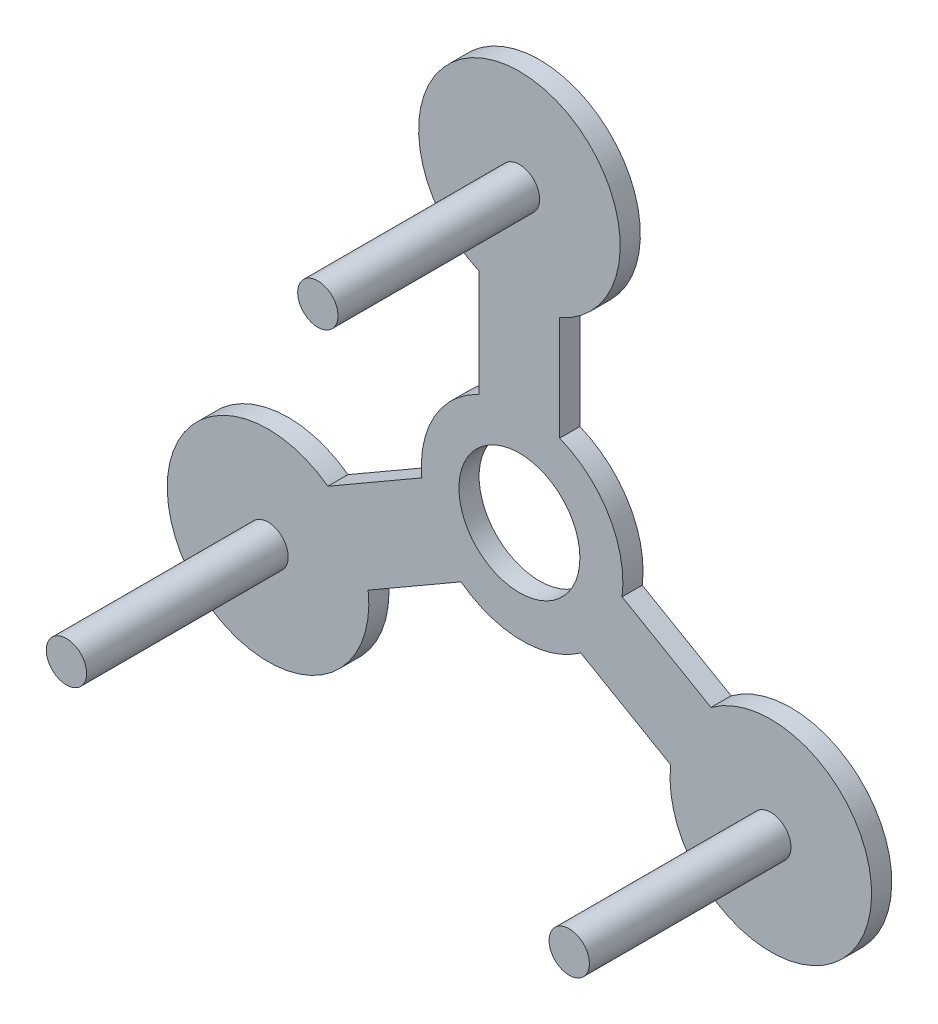
from build123d import *

# Parameters (mm, degrees)
BOSS_EXTRUDE2_DEPTH = 10
SKETCH3_R           = 50
BOSS_EXTRUDE3_DEPTH = 10
SKETCH4_R           = 10
BOSS_EXTRUDE4_DEPTH = 90
CUT_EXTRUDE1_START  = -30
SKETCH5_R           = 10
CUT_EXTRUDE1_DEPTH  = 30
SKETCH6_R           = 13
CUT_EXTRUDE2_DEPTH  = 10
SKETCH7_R           = 10
BOSS_EXTRUDE5_DEPTH = 30
SKETCH9_R           = 10
BOSS_EXTRUDE6_DEPTH = 10
SKETCH10_R          = 10
BOSS_EXTRUDE7_DEPTH = 10
SKETCH11_R          = 10
BOSS_EXTRUDE8_DEPTH = 10
SKETCH12_R          = 50
BOSS_EXTRUDE9_DEPTH = 10
SKETCH13_R          = 30
CUT_EXTRUDE3_DEPTH  = 10
SCALE1_SCALE        = 0.2


with BuildPart() as part:
    # Sketch1 → Boss-Extrude2 (new body)
    with BuildSketch(Plane.XY):
        Polygon((20, 144), (-20, 144), (-20, 11.547005384), (-134.707658145, -54.679491924), (-114.707658145, -89.320508076), (0, -23.094010768), (114.707658145, -89.320508076), (134.707658145, -54.679491924), (20, 11.547005384), align=None)
    extrude(amount=BOSS_EXTRUDE2_DEPTH)

    # Sketch3 → Boss-Extrude3 (add)
    with BuildSketch(Plane.XY.offset(10)):
        with Locations((-124.707658145, -72)):
            Circle(SKETCH3_R)
        with Locations((0, 144)):
            Circle(SKETCH3_R)
        with Locations((124.707658145, -72)):
            Circle(SKETCH3_R)
    extrude(amount=-BOSS_EXTRUDE3_DEPTH)

    # Sketch4 → Boss-Extrude4 (add)
    with BuildSketch(Plane.XY.offset(10)):
        with Locations(Location((0, 144, 0), (0, 0, 180))):
            Circle(SKETCH4_R)
        with Locations(Location((124.707658145, -72, 0), (0, 0, 180))):
            Circle(SKETCH4_R)
        with Locations(Location((-124.707658145, -72, 0), (0, 0, 180))):
            Circle(SKETCH4_R)
    extrude(amount=BOSS_EXTRUDE4_DEPTH)

    # Sketch5 → Cut-Extrude1 (cut)
    with BuildSketch(Plane.XY.offset(100).offset(CUT_EXTRUDE1_START)):
        with Locations(Location((0, 144, 0), (0, 0, 180))):
            Circle(SKETCH5_R)
    extrude(amount=CUT_EXTRUDE1_DEPTH, mode=Mode.SUBTRACT)

    # Sketch6 → Cut-Extrude2 (cut)
    with BuildSketch(Plane.XY.offset(10)):
        Circle(SKETCH6_R)
    extrude(amount=-CUT_EXTRUDE2_DEPTH, mode=Mode.SUBTRACT)

    # Sketch7 → Boss-Extrude5 (add)
    with BuildSketch(Plane.XY.offset(70)):
        with Locations(Location((0, 144, 0), (0, 0, 180))):
            Circle(SKETCH7_R)
    extrude(amount=BOSS_EXTRUDE5_DEPTH)

    # Sketch9 → Boss-Extrude6 (add)
    with BuildSketch(Plane.XY.offset(100)):
        with Locations(Location((0, 144, 0), (0, 0, 180))):
            Circle(SKETCH9_R)
    extrude(amount=BOSS_EXTRUDE6_DEPTH)

    # Sketch10 → Boss-Extrude7 (add)
    with BuildSketch(Plane.XY.offset(100)):
        with Locations(Location((-124.707658145, -72, 0), (0, 0, 180))):
            Circle(SKETCH10_R)
    extrude(amount=BOSS_EXTRUDE7_DEPTH)

    # Sketch11 → Boss-Extrude8 (add)
    with BuildSketch(Plane.XY.offset(100)):
        with Locations(Location((124.707658145, -72, 0), (0, 0, 180))):
            Circle(SKETCH11_R)
    extrude(amount=BOSS_EXTRUDE8_DEPTH)

    # Sketch12 → Boss-Extrude9 (add)
    with BuildSketch(Plane.XY.offset(10)):
        with Locations((1.330805308, 0)):
            Circle(SKETCH12_R)
    extrude(amount=-BOSS_EXTRUDE9_DEPTH)

    # Sketch13 → Cut-Extrude3 (cut)
    with BuildSketch(Plane.XY.offset(10)):
        Circle(SKETCH13_R)
    extrude(amount=-CUT_EXTRUDE3_DEPTH, mode=Mode.SUBTRACT)


with BuildPart() as part_1:
    # Scale1: scaled about (0.145453699, 0.001217976, 16.882898765)
    add(part.part.scale(SCALE1_SCALE).moved(Location((0.116362959, 0.000974381, 13.506319012))))


solid = part_1.part
